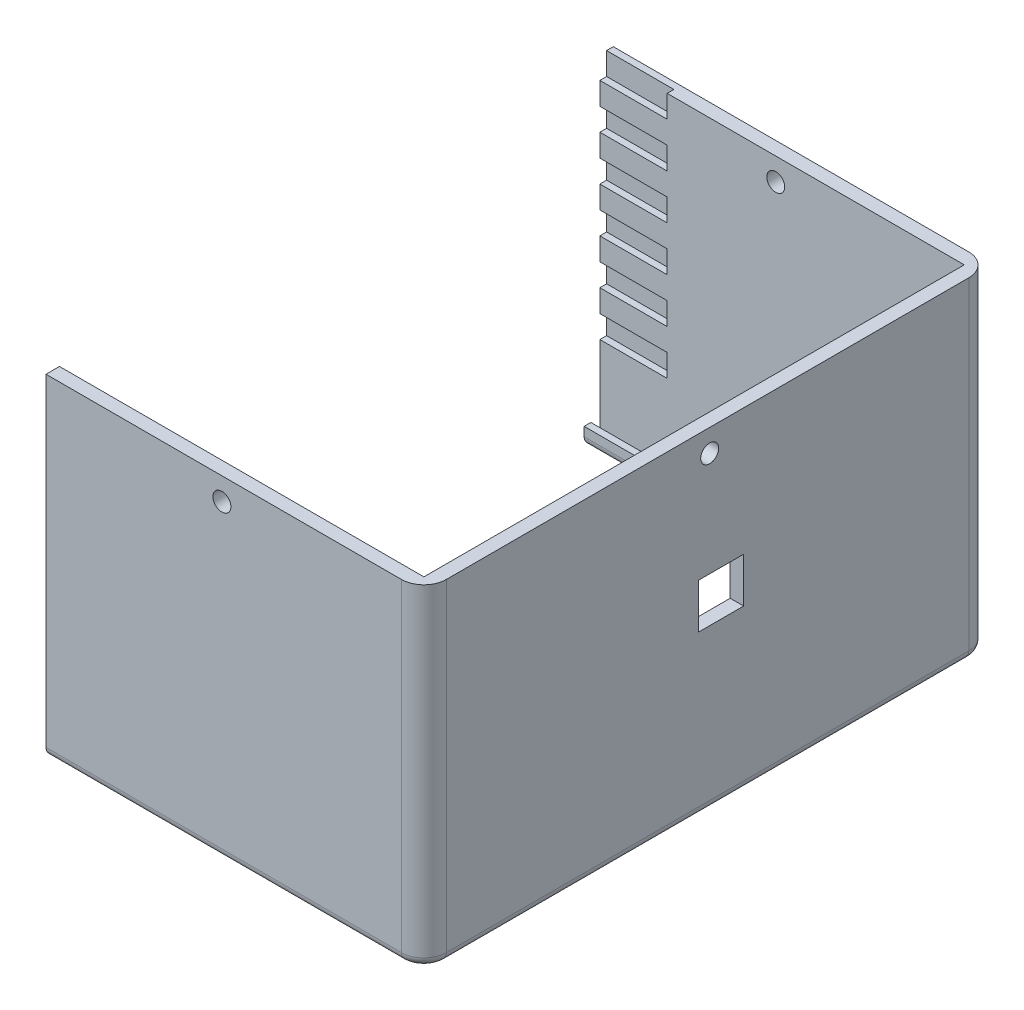
from build123d import *

# Parameters (mm, degrees)
SKETCH1_W           = 168.379590863
SKETCH1_H           = 126.39
BOSS_EXTRUDE1_DEPTH = 70
SKETCH2_W           = 168.379590863
SKETCH2_H           = 126.39
BOSS_EXTRUDE2_DEPTH = 4
SKETCH3_W           = 142.779590863
SKETCH3_H           = 96.34
CUT_EXTRUDE1_DEPTH  = 4
FILLET1_R           = 5
FILLET4_R           = 2
FILLET5_R           = 2
SKETCH4_W           = 10
SKETCH4_H           = 10
CUT_EXTRUDE2_DEPTH  = 195
SKETCH6_R           = 2
CUT_EXTRUDE3_DEPTH  = 195
SKETCH8_R           = 2
CUT_EXTRUDE4_DEPTH  = 195
SKETCH9_W           = 103.95032351
SKETCH9_H           = 88.010158037
CUT_EXTRUDE5_DEPTH  = 201
SKETCH10_W          = 5
SKETCH10_H          = 2
SKETCH10_W_2        = 2
CUT_EXTRUDE6_DEPTH  = 15
SKETCH11_W          = 1.5
SKETCH11_H          = 5
CUT_EXTRUDE7_DEPTH  = 15
SKETCH12_W          = 1.5
SKETCH12_H          = 5
CUT_EXTRUDE8_DEPTH  = 15


with BuildPart() as part:
    # Sketch1 → Boss-Extrude1 (new body)
    with BuildSketch(Plane(origin=(0, 0, 0), x_dir=(1, 0, 0), z_dir=(0, 1, 0))):
        with Locations((4.455204569, -8.048213198)):
            Rectangle(SKETCH1_W, SKETCH1_H)
        Polygon((-76.734590863, 32.146786802), (-76.734590863, 52.146786802), (85.645, 52.146786802), (85.645, -68.243213198), (60.555409137, -68.243213198), (-76.734590863, -68.243213198), align=None, mode=Mode.SUBTRACT)
    extrude(amount=BOSS_EXTRUDE1_DEPTH)

    # Sketch2 → Boss-Extrude2 (add)
    with BuildSketch(Plane(origin=(0, 0, 0), x_dir=(-1, 0, 0), z_dir=(0, -1, 0))):
        with Locations((-4.455204569, -8.048213198)):
            Rectangle(SKETCH2_W, SKETCH2_H)
    extrude(amount=BOSS_EXTRUDE2_DEPTH)

    # Sketch3 → Cut-Extrude1 (cut)
    with BuildSketch(Plane(origin=(0, 0, 0), x_dir=(1, 0, 0), z_dir=(0, 1, 0))):
        with Locations((9.755204569, 0.476786802)):
            Rectangle(SKETCH3_W, SKETCH3_H)
    extrude(amount=-CUT_EXTRUDE1_DEPTH, mode=Mode.SUBTRACT)

    # Fillet1
    fillet1_edges = [part.edges().sort_by_distance(p)[0] for p in [
        (-79.734590863, 33, -55.146786802),
        (88.645, 33, -55.146786802),
        (88.645, 33, 71.243213198),
        (-79.734590863, 33, 71.243213198),
    ]]
    fillet(fillet1_edges, radius=FILLET1_R)

    # Fillet4
    fillet4_edges = [part.edges().sort_by_distance(p)[0] for p in [
        (4.455204569, -4, 71.243213198),
        (-79.734590863, -4, 8.048213198),
        (4.455204569, -4, -55.146786802),
        (88.645, -4, 8.048213198),
        (87.180533906, -4, 69.778747104),
        (87.180533906, -4, -53.682320708),
        (-78.270124769, -4, -53.682320708),
        (-78.270124769, -4, 69.778747104),
    ]]
    fillet(fillet4_edges, radius=FILLET4_R)

    # Fillet5
    fillet5_edges = [part.edges().sort_by_distance(p)[0] for p in [
        (81.145, -4, -0.476786802),
        (9.755204569, -4, 47.693213198),
        (-61.634590863, -4, -0.476786802),
        (9.755204569, -4, -48.646786802),
    ]]
    fillet(fillet5_edges, radius=FILLET5_R)

    # Sketch4 → Cut-Extrude2 (cut)
    with BuildSketch(Plane.ZY.offset(79.734590863)):
        with Locations((5.00870497, 36.749697215)):
            Rectangle(SKETCH4_W, SKETCH4_H)
    extrude(amount=-CUT_EXTRUDE2_DEPTH, mode=Mode.SUBTRACT)

    # Sketch6 → Cut-Extrude3 (cut)
    with BuildSketch(Plane(origin=(88.645, 0, 0), x_dir=(0, 0, -1), z_dir=(1, 0, 0))):
        with Locations((-7.57558331, 65)):
            Circle(SKETCH6_R)
    extrude(amount=-CUT_EXTRUDE3_DEPTH, mode=Mode.SUBTRACT)

    # Sketch8 → Cut-Extrude4 (cut)
    with BuildSketch(Plane(origin=(0, 0, -55.146786802), x_dir=(-1, 0, 0), z_dir=(0, 0, -1))):
        with Locations((-43.645, 65)):
            Circle(SKETCH8_R)
        with Locations((34.734590863, 65)):
            Circle(SKETCH8_R)
    extrude(amount=-CUT_EXTRUDE4_DEPTH, mode=Mode.SUBTRACT)

    # Sketch9 → Cut-Extrude5 (cut)
    with BuildSketch(Plane.XY.offset(71.243213198)):
        with Locations((-47.519957186, 25.994920982)):
            Rectangle(SKETCH9_W, SKETCH9_H)
    extrude(amount=-CUT_EXTRUDE5_DEPTH, mode=Mode.SUBTRACT)

    # Sketch10 → Cut-Extrude6 (cut)
    with BuildSketch(Plane.ZY.offset(-4.455204569)):
        with Locations((55.193213198, -1)):
            Rectangle(SKETCH10_W, SKETCH10_H)
        with Locations((65.193213198, -1)):
            Rectangle(SKETCH10_W, SKETCH10_H)
        with Locations((-51.146786802, -1)):
            Rectangle(SKETCH10_W_2, SKETCH10_H)
    extrude(amount=-CUT_EXTRUDE6_DEPTH, mode=Mode.SUBTRACT)

    # Sketch11 → Cut-Extrude7 (cut)
    with BuildSketch(Plane.ZY.offset(-4.455204569)):
        with Locations((68.993213198, 62.5)):
            Rectangle(SKETCH11_W, SKETCH11_H)
        with Locations((68.993213198, 52.5)):
            Rectangle(SKETCH11_W, SKETCH11_H)
        with Locations((68.993213198, 42.5)):
            Rectangle(SKETCH11_W, SKETCH11_H)
        with Locations((68.993213198, 32.5)):
            Rectangle(SKETCH11_W, SKETCH11_H)
        with Locations((68.993213198, 22.5)):
            Rectangle(SKETCH11_W, SKETCH11_H)
        with Locations((68.993213198, 12.5)):
            Rectangle(SKETCH11_W, SKETCH11_H)
    extrude(amount=-CUT_EXTRUDE7_DEPTH, mode=Mode.SUBTRACT)

    # Sketch12 → Cut-Extrude8 (cut)
    with BuildSketch(Plane.ZY.offset(-4.455204569)):
        with Locations((-52.896786802, 57.5)):
            Rectangle(SKETCH12_W, SKETCH12_H)
        with Locations((-52.896786802, 67.5)):
            Rectangle(SKETCH12_W, SKETCH12_H)
        with Locations((-52.896786802, 47.5)):
            Rectangle(SKETCH12_W, SKETCH12_H)
        with Locations((-52.896786802, 37.5)):
            Rectangle(SKETCH12_W, SKETCH12_H)
        with Locations((-52.896786802, 27.5)):
            Rectangle(SKETCH12_W, SKETCH12_H)
        with Locations((-52.896786802, 17.5)):
            Rectangle(SKETCH12_W, SKETCH12_H)
    extrude(amount=-CUT_EXTRUDE8_DEPTH, mode=Mode.SUBTRACT)


solid = part.part
